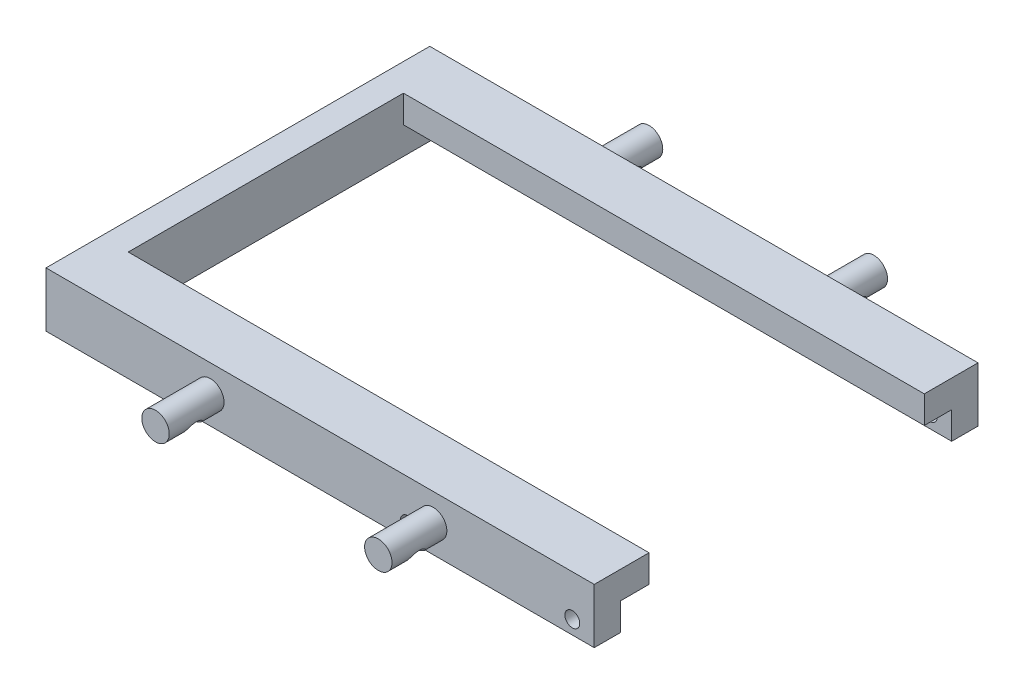
from build123d import *

# Parameters (mm, degrees)
SKETCH1_W                       = 6.35
SKETCH1_H                       = 88.9
BOSS_EXTRUDE1_DEPTH             = 6.35
SKETCH2_W                       = 12.7
SKETCH2_H                       = 6.35
BOSS_EXTRUDE2_DEPTH             = 120.65
SKETCH3_W                       = 12.446
SKETCH3_H                       = 6.35
BOSS_EXTRUDE3_DEPTH             = 120.65
SKETCH1_2_W                     = 6.35
SKETCH1_2_H                     = 88.9
BOSS_EXTRUDE4_DEPTH             = 6.35
SKETCH4_W                       = 6.096
SKETCH4_H                       = 6.35
BOSS_EXTRUDE5_DEPTH             = 120.65
SKETCH5_W                       = 6.096
SKETCH5_H                       = 6.35
BOSS_EXTRUDE6_DEPTH             = 120.65
F_8_32_TAPPED_HOLE1_D           = 3.4544
F_8_32_TAPPED_HOLE1_ON_FACE_2_D = 3.4544
SKETCH7_R                       = 3.175
BOSS_EXTRUDE7_DEPTH             = 12.7
SKETCH8_R                       = 3.175
BOSS_EXTRUDE8_DEPTH             = 12.7
SKETCH9_R                       = 3.175
BOSS_EXTRUDE10_DEPTH            = 12.7
SKETCH10_R                      = 3.175
BOSS_EXTRUDE11_DEPTH            = 12.7
SKETCH12_R                      = 2.38125
CUT_EXTRUDE2_DEPTH              = 127
SKETCH13_R                      = 2.38125
CUT_EXTRUDE3_DEPTH              = 127


with BuildPart() as part:
    # Sketch1 → Boss-Extrude1 (new body)
    with BuildSketch(Plane(origin=(0, 0, 0), x_dir=(1, 0, 0), z_dir=(0, 1, 0))):
        with Locations((-73.025, 0)):
            Rectangle(SKETCH1_W, SKETCH1_H)
    extrude(amount=BOSS_EXTRUDE1_DEPTH)

    # Sketch2 → Boss-Extrude2 (add)
    with BuildSketch(Plane(origin=(-69.85, 0, 0), x_dir=(0, 0, -1), z_dir=(1, 0, 0))):
        with Locations((-38.1, 3.175)):
            Rectangle(SKETCH2_W, SKETCH2_H)
    extrude(amount=BOSS_EXTRUDE2_DEPTH)

    # Sketch3 → Boss-Extrude3 (add)
    with BuildSketch(Plane(origin=(-69.85, 0, 0), x_dir=(0, 0, -1), z_dir=(1, 0, 0))):
        with Locations((38.227, 3.175)):
            Rectangle(SKETCH3_W, SKETCH3_H)
    extrude(amount=BOSS_EXTRUDE3_DEPTH)

    # Sketch1<2> → Boss-Extrude4 (add)
    with BuildSketch(Plane(origin=(0, 0, 0), x_dir=(1, 0, 0), z_dir=(0, 1, 0))):
        with Locations((-73.025, 0)):
            Rectangle(SKETCH1_2_W, SKETCH1_2_H)
    extrude(amount=-BOSS_EXTRUDE4_DEPTH)

    # Sketch4 → Boss-Extrude5 (add)
    with BuildSketch(Plane(origin=(-69.85, 0, 0), x_dir=(0, 0, -1), z_dir=(1, 0, 0))):
        with Locations((-41.402, -3.175)):
            Rectangle(SKETCH4_W, SKETCH4_H)
    extrude(amount=BOSS_EXTRUDE5_DEPTH)

    # Sketch5 → Boss-Extrude6 (add)
    with BuildSketch(Plane(origin=(-69.85, 0, 0), x_dir=(0, 0, -1), z_dir=(1, 0, 0))):
        with Locations((41.402, -3.175)):
            Rectangle(SKETCH5_W, SKETCH5_H)
    extrude(amount=BOSS_EXTRUDE6_DEPTH)

    # #8-32 Tapped Hole1 (through all)
    with Locations(Plane(origin=(45.72, -3.175, -44.45), x_dir=(-1, 0, 0), z_dir=(0, 0, -1))):
        with Locations((0, 0), (38.1, 0)):
            Hole(F_8_32_TAPPED_HOLE1_D / 2)

    # #8-32 Tapped Hole1 on face 2 (through all)
    with Locations(Plane(origin=(45.72, -3.175, 44.45), x_dir=(1, 0, 0), z_dir=(0, 0, 1))):
        with Locations((0, 0), (-38.1, 0)):
            Hole(F_8_32_TAPPED_HOLE1_ON_FACE_2_D / 2)

    # Sketch7 → Boss-Extrude7 (add)
    with BuildSketch(Plane(origin=(-14.456865446, 0, 44.45), x_dir=(1, 0, 0), z_dir=(0, 0, 1))):
        with Locations(Location((27.94, 0, 0), (0, 0, 180))):
            Circle(SKETCH7_R)
    extrude(amount=BOSS_EXTRUDE7_DEPTH)

    # Sketch8 → Boss-Extrude8 (add)
    with BuildSketch(Plane.XY.offset(44.45)):
        with Locations(Location((-38.12905493, 0, 0), (0, 0, 180))):
            Circle(SKETCH8_R)
    extrude(amount=BOSS_EXTRUDE8_DEPTH)

    # Sketch9 → Boss-Extrude10 (add)
    with BuildSketch(Plane(origin=(0, 0, -44.45), x_dir=(-1, 0, 0), z_dir=(0, 0, -1))):
        with Locations(Location((38.1, 0, 0), (0, 0, 180))):
            Circle(SKETCH9_R)
    extrude(amount=BOSS_EXTRUDE10_DEPTH)

    # Sketch10 → Boss-Extrude11 (add)
    with BuildSketch(Plane(origin=(0, 0, -44.45), x_dir=(-1, 0, 0), z_dir=(0, 0, -1))):
        with Locations(Location((-13.97, 0, 0), (0, 0, 180))):
            Circle(SKETCH10_R)
    extrude(amount=BOSS_EXTRUDE11_DEPTH)

    # Sketch12 → Cut-Extrude2 (cut)
    with BuildSketch(Plane(origin=(17.145, 0, 0), x_dir=(0, 0, -1), z_dir=(1, 0, 0))):
        with Locations((50.8, -3.048)):
            Circle(SKETCH12_R)
    extrude(amount=-CUT_EXTRUDE2_DEPTH, mode=Mode.SUBTRACT)

    # Sketch13 → Cut-Extrude3 (cut)
    with BuildSketch(Plane(origin=(17.145, 0, 0), x_dir=(0, 0, -1), z_dir=(1, 0, 0))):
        with Locations((-50.8, -3.175)):
            Circle(SKETCH13_R)
    extrude(amount=-CUT_EXTRUDE3_DEPTH, mode=Mode.SUBTRACT)


solid = part.part
